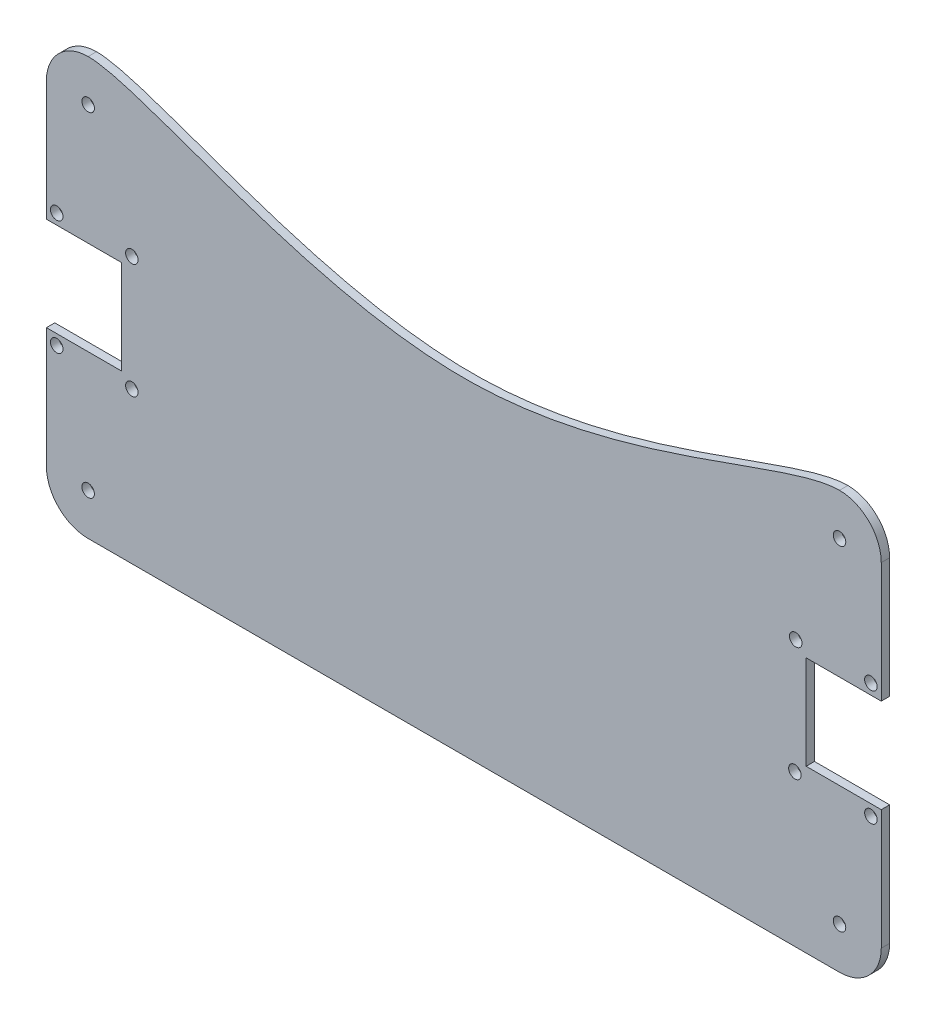
from build123d import *

# Parameters (mm, degrees)
SKETCH1_R           = 1.5
BOSS_EXTRUDE5_DEPTH = 2


with BuildPart() as part:
    # Sketch1 → Boss-Extrude5 (new body)
    with BuildSketch(Plane.XY):
        with BuildLine():
            Line((-96.208405317, 32.365381328), (-96.208405317, 3.615381328))
            Line((-96.208405317, 3.615381328), (-78.208405317, 3.615381328))
            Line((-78.208405317, 3.615381328), (-78.208405317, -7.634618672))
            Line((-78.208405317, -7.634618672), (-78.208405317, -18.884618672))
            Line((-78.208405317, -18.884618672), (-96.208405317, -18.884618672))
            Line((-96.208405317, -18.884618672), (-96.208405317, -47.634618672))
            ThreePointArc((-96.208405317, -47.634618672), (-93.279473129, -54.705686484), (-86.208405317, -57.634618672))
            Line((-86.208405317, -57.634618672), (93.786822591, -57.634618672))
            ThreePointArc((93.786822591, -57.634618672), (100.857890403, -54.705686484), (103.786822591, -47.634618672))
            Line((103.786822591, -47.634618672), (103.786822591, -18.884618672))
            Line((103.786822591, -18.884618672), (85.791594683, -18.884618672))
            Line((85.791594683, -18.884618672), (85.791594683, -7.634618672))
            Line((85.791594683, -7.634618672), (85.791594683, 3.615381328))
            Line((85.791594683, 3.615381328), (103.786822591, 3.615381328))
            Line((103.786822591, 3.615381328), (103.786822591, 32.365381328))
            ThreePointArc((103.786822591, 32.365381328), (100.857890403, 39.43644914), (93.786822591, 42.365381328))
            add(Edge.make_bspline(
                [(93.786822591, 42.365381328), (80.365609536, 42.377038483), (3.810151403, -1.044125651), (-72.829077796, 42.354133189), (-86.208405317, 42.365381328)],
                knots=[0, 0, 0, 0, 0.5, 1, 1, 1, 1], degree=3))
            ThreePointArc((-86.208405317, 42.365381328), (-93.279473129, 39.43644914), (-96.208405317, 32.365381328))
        make_face()
        with Locations((93.786822591, 32.365381328)):
            Circle(SKETCH1_R, mode=Mode.SUBTRACT)
        with Locations((-86.208405317, 32.365381328)):
            Circle(SKETCH1_R, mode=Mode.SUBTRACT)
        with Locations((-86.208405317, -47.634618672)):
            Circle(SKETCH1_R, mode=Mode.SUBTRACT)
        with Locations((101.306428837, 6.128192253)):
            Circle(SKETCH1_R, mode=Mode.SUBTRACT)
        with Locations((83.303914286, 6.128192253)):
            Circle(SKETCH1_R, mode=Mode.SUBTRACT)
        with Locations((83.103049409, -21.36518771)):
            Circle(SKETCH1_R, mode=Mode.SUBTRACT)
        with Locations((101.306428837, -21.498180437)):
            Circle(SKETCH1_R, mode=Mode.SUBTRACT)
        with Locations((-93.738164493, 6.128192253)):
            Circle(SKETCH1_R, mode=Mode.SUBTRACT)
        with Locations((-75.737858718, 6.128192253)):
            Circle(SKETCH1_R, mode=Mode.SUBTRACT)
        with Locations((-75.737858718, -21.36518771)):
            Circle(SKETCH1_R, mode=Mode.SUBTRACT)
        with Locations((-93.738164493, -21.36518771)):
            Circle(SKETCH1_R, mode=Mode.SUBTRACT)
        with Locations((93.786822591, -47.634618672)):
            Circle(SKETCH1_R, mode=Mode.SUBTRACT)
    extrude(amount=BOSS_EXTRUDE5_DEPTH)


solid = part.part
